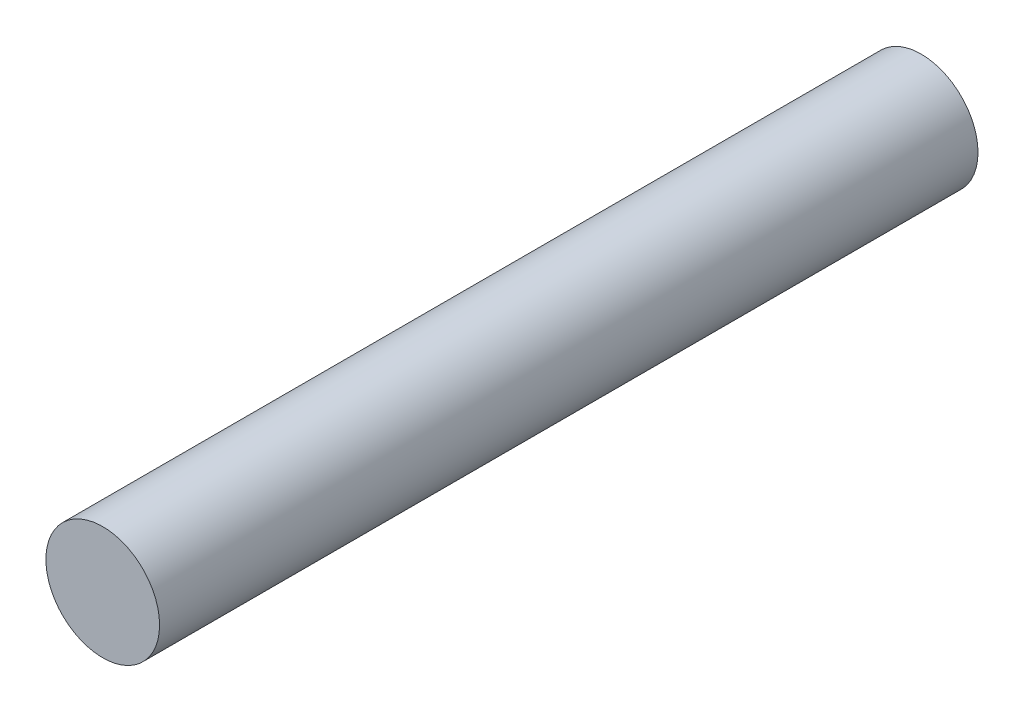
from build123d import *

# Parameters (mm, degrees)
SKETCH_1_R      = 5
EXTRUDE_1_DEPTH = 72


with BuildPart() as part:
    # 草图1 → 凸台-拉伸1 (new body)
    with BuildSketch(Plane.XY):
        Circle(SKETCH_1_R)
    extrude(amount=EXTRUDE_1_DEPTH)


solid = part.part
